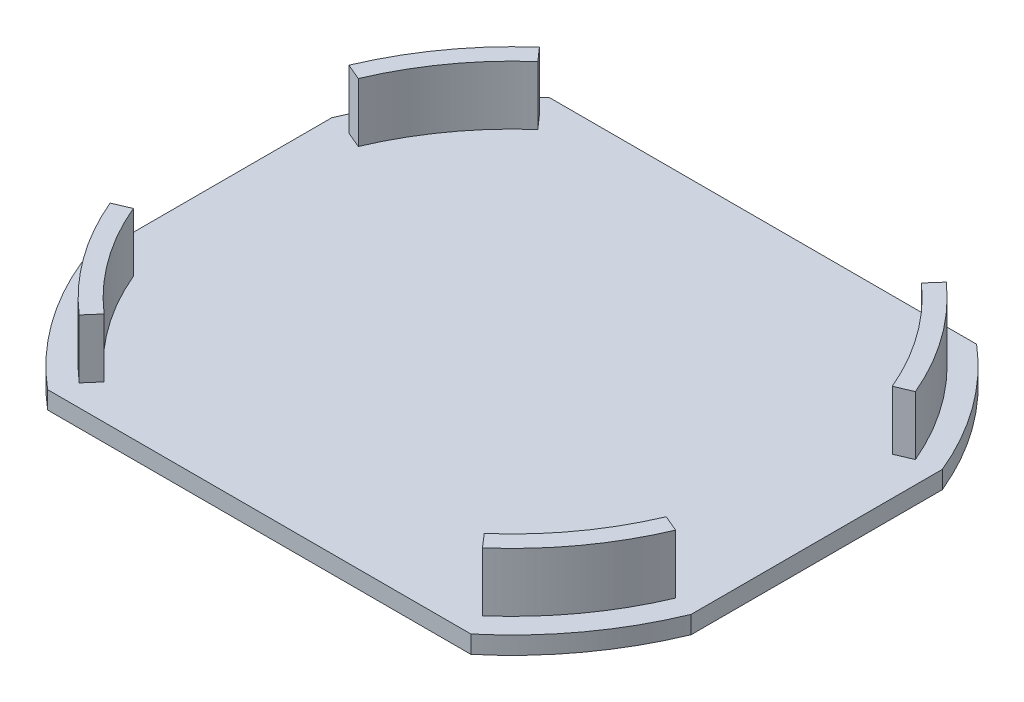
from build123d import *

# Parameters (mm, degrees)
BOSS_EXTRUDE1_DEPTH = 1.5
BOSS_EXTRUDE2_DEPTH = 5


with BuildPart() as part:
    # Sketch1 → Boss-Extrude1 (new body)
    with BuildSketch(Plane(origin=(0, 0, 0), x_dir=(1, 0, 0), z_dir=(0, 1, 0))):
        with BuildLine():
            Line((-25.910177173, 10.614269588), (-25.910177173, -10.614269588))
            ThreePointArc((-25.910177173, -10.614269588), (-22.603967361, -16.524547181), (-17.975471458, -21.468172392))
            Line((-17.975471458, -21.468172392), (17.975471458, -21.468172392))
            ThreePointArc((17.975471458, -21.468172392), (22.588149859, -16.546162273), (25.889822827, -10.663820796))
            Line((25.889822827, -10.663820796), (25.889822827, 10.663820796))
            ThreePointArc((25.889822827, 10.663820796), (22.650459328, 16.460762201), (18.137065113, 21.331827608))
            Line((18.137065113, 21.331827608), (-18.137065113, 21.331827608))
            ThreePointArc((-18.137065113, 21.331827608), (-22.666195109, 16.439087544), (-25.910177173, 10.614269588))
        make_face()
    extrude(amount=BOSS_EXTRUDE1_DEPTH)

    # Sketch2 → Boss-Extrude2 (add)
    with BuildSketch(Plane(origin=(0, 1.5, 0), x_dir=(1, 0, 0), z_dir=(0, 1, 0))):
        with BuildLine():
            Line((-17.283724515, 19.613012201), (-16.290407014, 18.48903696))
            ThreePointArc((-16.290407014, 18.48903696), (-19.977953658, 14.409984138), (-22.667306708, 9.613730147))
            Line((-22.667306708, 9.613730147), (-24.049459557, 10.196528143))
            ThreePointArc((-24.049459557, 10.196528143), (-21.196121564, 15.285236646), (-17.283724515, 19.613012201))
        make_face()
        with BuildLine():
            Line((17.283724515, 19.613012201), (16.290407014, 18.48903696))
            ThreePointArc((16.290407014, 18.48903696), (19.963841864, 14.42960445), (22.648482765, 9.658250436))
            Line((22.648482765, 9.658250436), (24.029487812, 10.243763084))
            ThreePointArc((24.029487812, 10.243763084), (21.181149295, 15.306053319), (17.283724515, 19.613012201))
        make_face()
        with BuildLine():
            Line((22.648482765, -9.546564422), (24.029487812, -10.13207707))
            ThreePointArc((24.029487812, -10.13207707), (21.121707142, -15.276589528), (17.131154209, -19.635108099))
            Line((17.131154209, -19.635108099), (16.146605116, -18.503444243))
            ThreePointArc((16.146605116, -18.503444243), (19.907815927, -14.395415244), (22.648482765, -9.546564422))
        make_face()
        with BuildLine():
            Line((-24.049459557, -10.08484213), (-22.667306708, -9.502044133))
            ThreePointArc((-22.667306708, -9.502044133), (-19.922003884, -14.375849937), (-16.146605116, -18.503444243))
            Line((-16.146605116, -18.503444243), (-17.131154209, -19.635108099))
            ThreePointArc((-17.131154209, -19.635108099), (-21.136760219, -15.255831214), (-24.049459557, -10.08484213))
        make_face()
    extrude(amount=BOSS_EXTRUDE2_DEPTH)


solid = part.part
